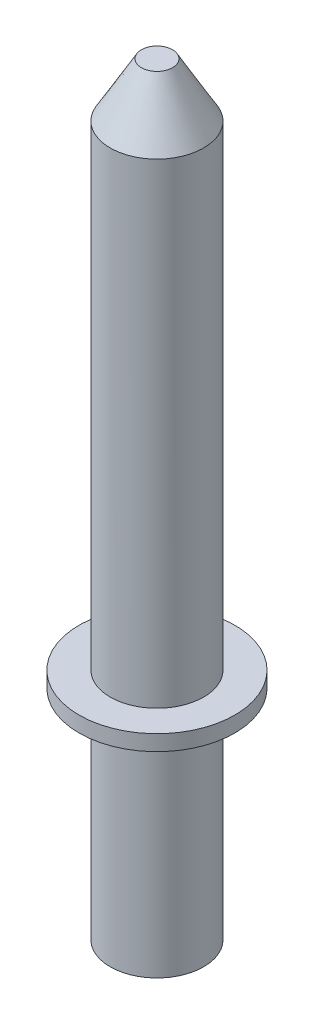
from build123d import *

# Parameters (mm, degrees)
SKETCH1_R           = 1.5
BOSS_EXTRUDE1_DEPTH = 7
SKETCH2_R           = 2.5
BOSS_EXTRUDE2_DEPTH = 0.5
SKETCH3_R           = 1.5
BOSS_EXTRUDE3_DEPTH = 17
CHAMFER1_SIZE       = 1
CHAMFER1_SIZE2      = 1.732050808


with BuildPart() as part:
    # Sketch1 → Boss-Extrude1 (new body)
    with BuildSketch(Plane(origin=(0, 0, 0), x_dir=(1, 0, 0), z_dir=(0, 1, 0))):
        with Locations(Location((0, 0, 0), (0, 0, 270))):
            Circle(SKETCH1_R)
    extrude(amount=BOSS_EXTRUDE1_DEPTH)

    # Sketch2 → Boss-Extrude2 (add)
    with BuildSketch(Plane(origin=(0, 7, 0), x_dir=(1, 0, 0), z_dir=(0, 1, 0))):
        with Locations(Location((0, 0, 0), (0, 0, 270))):
            Circle(SKETCH2_R)
    extrude(amount=BOSS_EXTRUDE2_DEPTH)

    # Sketch3 → Boss-Extrude3 (add)
    with BuildSketch(Plane(origin=(0, 7.5, 0), x_dir=(1, 0, 0), z_dir=(0, 1, 0))):
        with Locations(Location((0, 0, 0), (0, 0, 270))):
            Circle(SKETCH3_R)
    extrude(amount=BOSS_EXTRUDE3_DEPTH)

    # Chamfer1
    chamfer1_edges = [part.edges().sort_by_distance(p)[0] for p in [
        (0, 24.5, -1.5),
    ]]
    chamfer1_side = [part.faces().sort_by_distance(p)[0] for p in [
        (0, 24.5, 0),
    ]]
    chamfer(chamfer1_edges, length=CHAMFER1_SIZE, length2=CHAMFER1_SIZE2, reference=chamfer1_side[0])


solid = part.part
